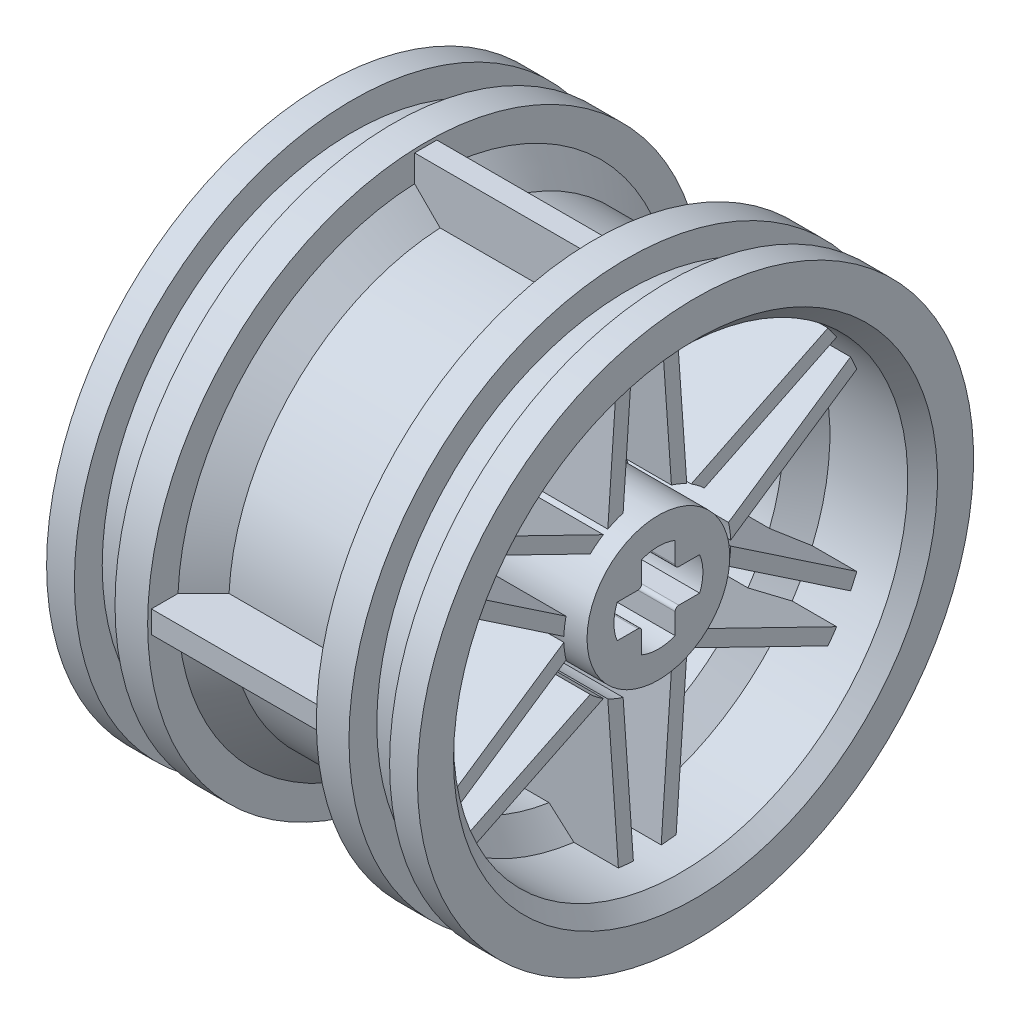
from build123d import *

# Parameters (mm, degrees)
BOSS_EXTRUDE1_REACH = 27.091
SKETCH3_R           = 1.45
SKETCH4_R           = 0.6
SKETCH4_R_2         = 1
CUT_EXTRUDE1_DEPTH  = 0.2
CUT_EXTRUDE2_REACH  = 29.821
SKETCH6_R           = 1.5
CUT_EXTRUDE3_DEPTH  = 30.154759474
RIB1_REACH          = 25.452
SKETCH7_WALL_W      = 58.004157598
SKETCH7_WALL_H      = 1.2
CIRPATTERN1_COUNT   = 4
BOSS_EXTRUDE2_REACH = 33.755
BOSS_EXTRUDE2_START = -2.6
CIRPATTERN2_COUNT   = 6
CHAMFER1_SIZE       = 0.8


with BuildPart() as part:
    # Sketch1 → Revolve1 (revolve)
    with BuildSketch(Plane.XY, mode=Mode.PRIVATE) as revolve1_sk:
        Polygon((10, 12.25), (10, 15), (8.5, 15), (8.5, 13.5), (6.31, 13.5), (6.31, 15), (4.55, 15), (4.55, 13.375), (3.175, 12), (-3.175, 12), (-4.55, 13.375), (-4.55, 15), (-6.31, 15), (-6.31, 13.5), (-8.5, 13.5), (-8.5, 15), (-10, 15), (-10, 12.25), (-5, 12.25), (-3.75, 11), (3.75, 11), (5, 12.25), align=None)
    revolve(revolve1_sk.sketch.rotate(Axis((0, 0, 0), (1, 0, 0)), 90), axis=Axis((0, 0, 0), (1, 0, 0)))

    # Sketch2 → Revolve3 (revolve)
    with BuildSketch(Plane.XY, mode=Mode.PRIVATE) as revolve3_sk:
        Polygon((1, 11), (2.37, 11), (0.5, 5.1), (0.5, 4.5), (2, 4.5), (2, 3.85), (8, 3.85), (8, 0), (0.6, 0), (0.6, 3.804964539), (-3.4, 3.804964539), (-3.4, 5.8), (-0.648135593, 5.8), align=None)
    revolve(revolve3_sk.sketch.rotate(Axis((0, 0, 0), (1, 0, 0)), 90), axis=Axis((0, 0, 0), (1, 0, 0)))

    # Boss-Extrude1: up to this cone (the profile starts outside it)
    boss_extrude1_end = Plane(origin=(-3.4, 0, 0), z_dir=(1, 0, 0)).offset(0.913560322) * Cone(3.155e-06, 84.169465241, 26.677439678, align=(Align.CENTER, Align.CENTER, Align.MIN), mode=Mode.PRIVATE)
    # Sketch3 → Boss-Extrude1 (add, up to the surface)
    with BuildSketch(Plane.ZY.offset(3.4), mode=Mode.PRIVATE) as boss_extrude1_sk1:
        with Locations((0, -6)):
            Circle(SKETCH3_R)
    boss_extrude1_tool1 = extrude(boss_extrude1_sk1.sketch, amount=-BOSS_EXTRUDE1_REACH, mode=Mode.PRIVATE) - boss_extrude1_end
    add(boss_extrude1_tool1.solids().sort_by_distance((-3.4, -6, 0))[0])

    # Sketch4 → Cut-Extrude1 (cut)
    with BuildSketch(Plane.ZY.offset(3.4)):
        with Locations((0, 4.75)):
            Circle(SKETCH4_R)
        with Locations((2.802423475, 3.835221332)):
            Circle(SKETCH4_R)
        with Locations((4.525437597, 1.443230596)):
            Circle(SKETCH4_R)
        with Locations((4.505389076, -1.504649219)):
            Circle(SKETCH4_R)
        with Locations((2.75, -3.872983346)):
            Circle(SKETCH4_R)
        with Locations(Location((-2.75, -3.872983346, 0), (0, 0, 180))):
            Circle(SKETCH4_R)
        with Locations(Location((-4.505389076, -1.504649219, 0), (0, 0, 180))):
            Circle(SKETCH4_R)
        with Locations(Location((-2.802423475, 3.835221332, 0), (0, 0, 180))):
            Circle(SKETCH4_R)
        with Locations(Location((-4.525437597, 1.443230596, 0), (0, 0, 180))):
            Circle(SKETCH4_R)
        with Locations((0, -6)):
            Circle(SKETCH4_R_2)
    extrude(amount=-CUT_EXTRUDE1_DEPTH, mode=Mode.SUBTRACT)

    # Sketch5 → Cut-Extrude2 (cut, up to next)
    with BuildSketch(Plane(origin=(8, 0, 0), x_dir=(0, 0, -1), z_dir=(1, 0, 0)), mode=Mode.PRIVATE) as cut_extrude2_sk1:
        with BuildLine():
            Line((0.9, 1.1), (0.9, 2.224859546))
            ThreePointArc((0.9, 2.224859546), (0, 2.4), (-0.9, 2.224859546))
            Line((-0.9, 2.224859546), (-0.9, 1.1))
            ThreePointArc((-0.9, 1.1), (-0.958578644, 0.958578644), (-1.1, 0.9))
            Line((-1.1, 0.9), (-2.224859546, 0.9))
            ThreePointArc((-2.224859546, 0.9), (-2.4, 0), (-2.224859546, -0.9))
            Line((-2.224859546, -0.9), (-1.1, -0.9))
            ThreePointArc((-1.1, -0.9), (-0.958578644, -0.958578644), (-0.9, -1.1))
            Line((-0.9, -1.1), (-0.9, -2.224859546))
            ThreePointArc((-0.9, -2.224859546), (0, -2.4), (0.9, -2.224859546))
            Line((0.9, -2.224859546), (0.9, -1.1))
            ThreePointArc((0.9, -1.1), (0.958578644, -0.958578644), (1.1, -0.9))
            Line((1.1, -0.9), (2.224859546, -0.9))
            ThreePointArc((2.224859546, -0.9), (2.4, 0), (2.224859546, 0.9))
            Line((2.224859546, 0.9), (1.1, 0.9))
            ThreePointArc((1.1, 0.9), (0.958578644, 0.958578644), (0.9, 1.1))
        make_face()
    cut_extrude2_tool1 = extrude(cut_extrude2_sk1.sketch, amount=-CUT_EXTRUDE2_REACH, mode=Mode.PRIVATE) & part.part
    add(cut_extrude2_tool1.solids().sort_by_distance((8, 0, 0))[0], mode=Mode.SUBTRACT)

    # Sketch6 → Cut-Extrude3 (cut, through all)
    with BuildSketch(Plane(origin=(10, 0, 0), x_dir=(0, 0, -1), z_dir=(1, 0, 0))):
        with Locations(Location((4, 6.92820323, 0), (0, 0, 312.736659869))):
            Circle(SKETCH6_R)
        with Locations(Location((8, 0, 0), (0, 0, 359.999999893))):
            Circle(SKETCH6_R)
        with Locations(Location((4, -6.92820323, 0), (0, 0, 314.943620974))):
            Circle(SKETCH6_R)
        with Locations(Location((-4, -6.92820323, 0), (0, 0, 345.85072804))):
            Circle(SKETCH6_R)
        with Locations((-8, 0)):
            Circle(SKETCH6_R)
        with Locations(Location((-4, 6.92820323, 0), (0, 0, 315.65164615))):
            Circle(SKETCH6_R)
    extrude(amount=-CUT_EXTRUDE3_DEPTH, mode=Mode.SUBTRACT)

    # Sketch7 wall → Rib1 (add, up to next)
    with BuildSketch(Plane(origin=(0, 14.8, 0), x_dir=(-1, 0, 0), z_dir=(0, -1, 0)), mode=Mode.PRIVATE) as rib1_sk1:
        Rectangle(SKETCH7_WALL_W, SKETCH7_WALL_H)
    rib1_tool1 = extrude(rib1_sk1.sketch, amount=RIB1_REACH, mode=Mode.PRIVATE) - part.part
    rib1 = rib1_tool1.solids().sort_by_distance((0, 14.8, 0))[0]
    add(rib1)

    # CirPattern1: Rib1 ×4 about axis
    cirpattern1_axis = Axis((0, 0, 0), (1, 0, 0))
    for i in range(1, CIRPATTERN1_COUNT):
        add(rib1.rotate(cirpattern1_axis, i * 360 / CIRPATTERN1_COUNT))

    # Sketch8 → Boss-Extrude2 (add, up to next)
    with BuildSketch(Plane(origin=(10, 0, 0), x_dir=(0, 0, -1), z_dir=(1, 0, 0)).offset(BOSS_EXTRUDE2_START), mode=Mode.PRIVATE) as boss_extrude2_sk1:
        with BuildLine():
            Line((1.55728457, 12.150611703), (2.128975364, 3.964525684))
            ThreePointArc((2.128975364, 3.964525684), (1.724567752, 4.156424674), (1.303095799, 4.307196459))
            Line((1.303095799, 4.307196459), (0.75, 12.227019261))
            ThreePointArc((0.75, 12.227019261), (1.154274686, 12.195497118), (1.55728457, 12.150611703))
        make_face()
    boss_extrude2_tool1 = extrude(boss_extrude2_sk1.sketch, amount=-BOSS_EXTRUDE2_REACH, mode=Mode.PRIVATE) - part.part
    # Sketch8 → Boss-Extrude2 (add, up to next)
    with BuildSketch(Plane(origin=(10, 0, 0), x_dir=(0, 0, -1), z_dir=(1, 0, 0)).offset(BOSS_EXTRUDE2_START), mode=Mode.PRIVATE) as boss_extrude2_sk2:
        with BuildLine():
            Line((-1.303095799, 4.307196459), (-0.75, 12.227019261))
            ThreePointArc((-0.75, 12.227019261), (-1.154274686, 12.195497118), (-1.55728457, 12.150611703))
            Line((-1.55728457, 12.150611703), (-2.128975364, 3.964525684))
            ThreePointArc((-2.128975364, 3.964525684), (-1.724567752, 4.156424674), (-1.303095799, 4.307196459))
        make_face()
    boss_extrude2_tool2 = extrude(boss_extrude2_sk2.sketch, amount=-BOSS_EXTRUDE2_REACH, mode=Mode.PRIVATE) - part.part
    boss_extrude2_1 = boss_extrude2_tool1.solids().sort_by_distance((7.4, 8.172301, -1.436348))[0]
    add(boss_extrude2_1)
    boss_extrude2_2 = boss_extrude2_tool2.solids().sort_by_distance((7.4, 8.172301, 1.436348))[0]
    add(boss_extrude2_2)
    boss_extrude2 = boss_extrude2_1 + boss_extrude2_2  # Boss-Extrude2 as one shape, for the pattern or mirror that repeats it

    # CirPattern2: Boss-Extrude2 ×6 about axis
    cirpattern2_axis = Axis((0, 0, 0), (1, 0, 0))
    for i in range(1, CIRPATTERN2_COUNT):
        add(boss_extrude2.rotate(cirpattern2_axis, i * 360 / CIRPATTERN2_COUNT))

    # Chamfer1
    chamfer1_edges = [part.edges().sort_by_distance(p)[0] for p in [
        (10, 0, -12.25),
        (-10, 0, -12.25),
    ]]
    chamfer(chamfer1_edges, length=CHAMFER1_SIZE)


solid = part.part
